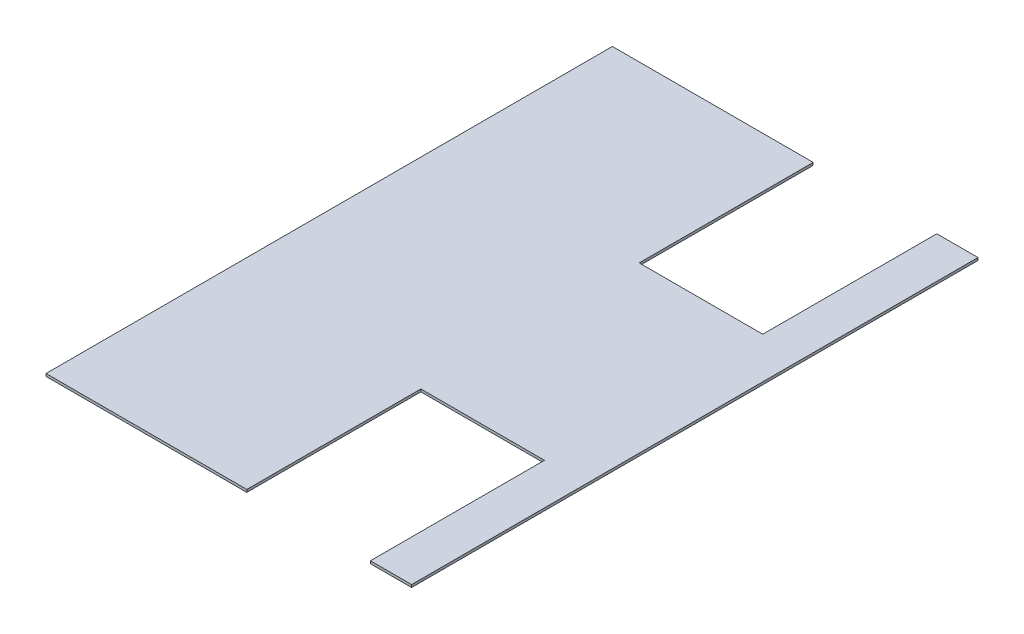
from build123d import *

# Parameters (mm, degrees)
BOSS_EXTRUDE1_DEPTH = 3.175


with BuildPart() as part:
    # Sketch1 → Boss-Extrude1 (new body)
    with BuildSketch(Plane(origin=(0, 0, 0), x_dir=(1, 0, 0), z_dir=(0, 1, 0))):
        Polygon((-11.815852537, 446.32626), (38.984147463, 446.32626), (38.984147463, -252.17374), (-11.815852537, -252.17374), (-11.815852537, -37.54374), (-164.215852537, -37.54374), (-164.215852537, -252.17374), (-411.865852537, -252.17374), (-411.865852537, 446.32626), (-164.215852537, 446.32626), (-164.215852537, 231.69626), (-11.815852537, 231.69626), align=None)
    extrude(amount=BOSS_EXTRUDE1_DEPTH)


solid = part.part
